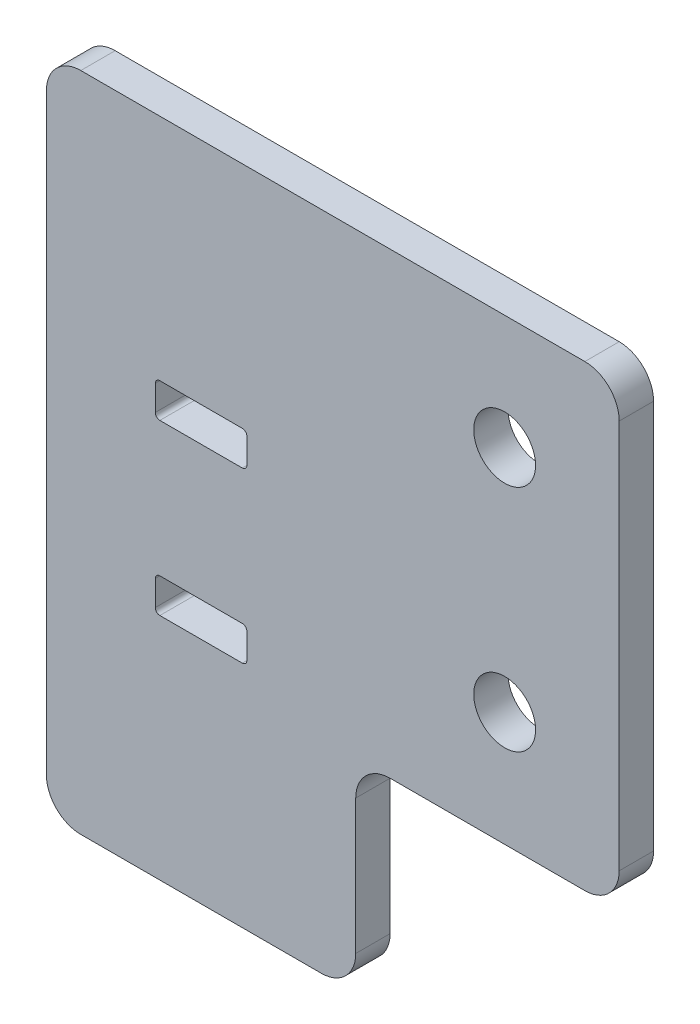
from build123d import *

# Parameters (mm, degrees)
MODEL_R                         = 2.7
AUFSATZ_LINEAR_AUSTRAGEN1_DEPTH = 3


with BuildPart() as part:
    # Model → Aufsatz-Linear austragen1 (new body)
    with BuildSketch(Plane.XY):
        with BuildLine():
            Line((50, 20.75), (50, 54.75))
            ThreePointArc((50, 54.75), (49.121320344, 56.871320344), (47, 57.75))
            Line((47, 57.75), (3, 57.75))
            ThreePointArc((3, 57.75), (0.878679656, 56.871320344), (0, 54.75))
            Line((0, 54.75), (0, 3))
            ThreePointArc((0, 3), (0.878679656, 0.878679656), (3, 0))
            Line((3, 0), (24, 0))
            ThreePointArc((24, 0), (26.121320344, 0.878679656), (27, 3))
            Line((27, 3), (27, 14.75))
            ThreePointArc((27, 14.75), (27.878679656, 16.871320344), (30, 17.75))
            Line((30, 17.75), (47, 17.75))
            ThreePointArc((47, 17.75), (49.121320344, 18.628679656), (50, 20.75))
        make_face()
        with Locations((40, 27.75)):
            Circle(MODEL_R, mode=Mode.SUBTRACT)
        with Locations((40, 47.75)):
            Circle(MODEL_R, mode=Mode.SUBTRACT)
        with BuildLine():
            Line((17.1, 34.75), (9.9, 34.75))
            ThreePointArc((9.9, 34.75), (9.617157288, 34.867157288), (9.5, 35.15))
            Line((9.5, 35.15), (9.5, 37.35))
            ThreePointArc((9.5, 37.35), (9.617157288, 37.632842712), (9.9, 37.75))
            Line((9.9, 37.75), (17.1, 37.75))
            ThreePointArc((17.1, 37.75), (17.382842712, 37.632842712), (17.5, 37.35))
            Line((17.5, 37.35), (17.5, 35.15))
            ThreePointArc((17.5, 35.15), (17.382842712, 34.867157288), (17.1, 34.75))
        make_face(mode=Mode.SUBTRACT)
        with BuildLine():
            Line((17.100000028, 20.000000104), (9.900000028, 20.000000104))
            ThreePointArc((9.900000028, 20.000000104), (9.617157315, 20.117157391), (9.500000028, 20.400000104))
            Line((9.500000028, 20.400000104), (9.500000028, 22.600000104))
            ThreePointArc((9.500000028, 22.600000104), (9.617157315, 22.882842816), (9.900000028, 23.000000104))
            Line((9.900000028, 23.000000104), (17.100000028, 23.000000104))
            ThreePointArc((17.100000028, 23.000000104), (17.38284274, 22.882842816), (17.500000028, 22.600000104))
            Line((17.500000028, 22.600000104), (17.500000028, 20.400000104))
            ThreePointArc((17.500000028, 20.400000104), (17.38284274, 20.117157391), (17.100000028, 20.000000104))
        make_face(mode=Mode.SUBTRACT)
    extrude(amount=AUFSATZ_LINEAR_AUSTRAGEN1_DEPTH)


solid = part.part
